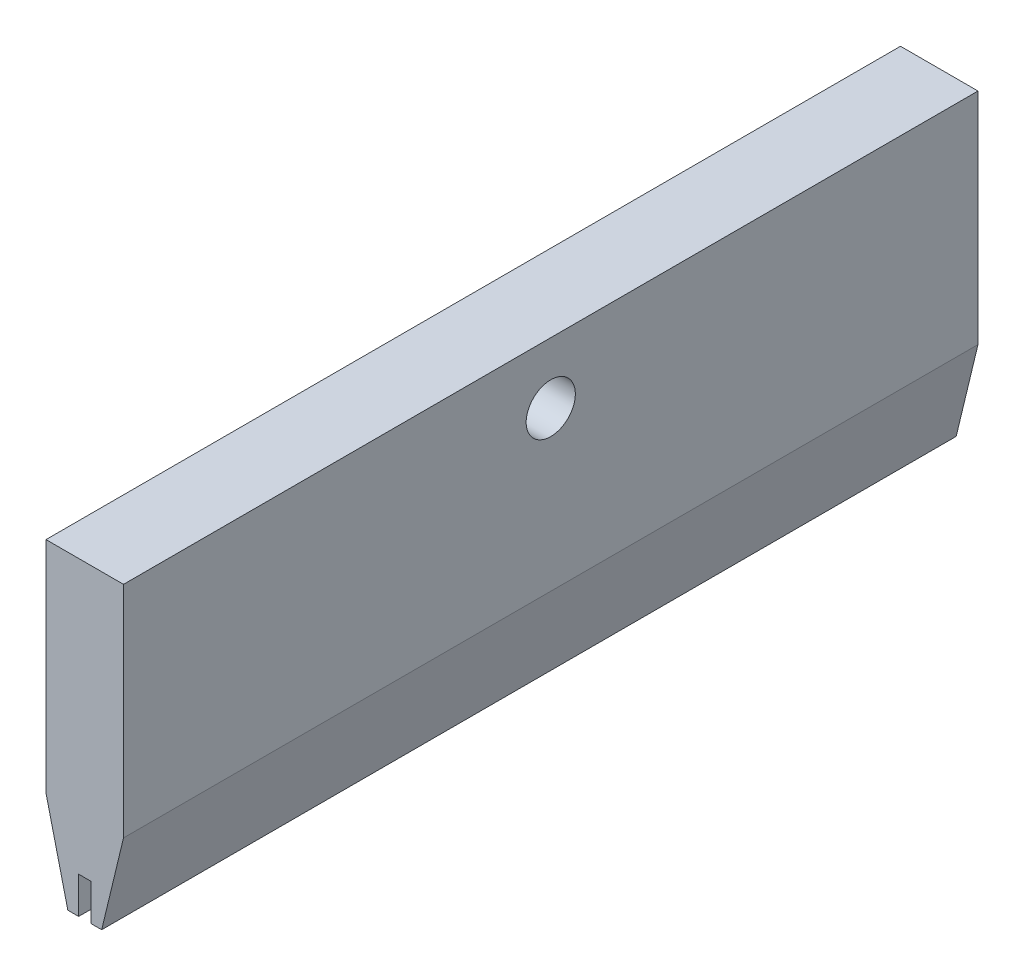
from build123d import *

# Parameters (mm, degrees)
SALIENTE_EXTRUIR1_DEPTH = 140
CROQUIS2_R              = 4.029640203
CORTAR_EXTRUIR1_DEPTH   = 140


with BuildPart() as part:
    # Croquis1 → Saliente-Extruir1 (new body)
    with BuildSketch(Plane.XY):
        Polygon((-1, -25.4), (-2.773222037, -25.4), (-6.35, -10.576393443), (-6.35, 25.4), (6.35, 25.4), (6.35, -10.576393443), (2.773222037, -25.4), (1, -25.4), (1, -19.4), (-1, -19.4), align=None)
    extrude(amount=SALIENTE_EXTRUIR1_DEPTH)

    # Croquis2 → Cortar-Extruir1 (cut)
    with BuildSketch(Plane(origin=(6.35, 0, 0), x_dir=(0, 0, -1), z_dir=(1, 0, 0))):
        with Locations((-70, 15.4)):
            Circle(CROQUIS2_R)
    extrude(amount=-CORTAR_EXTRUIR1_DEPTH, mode=Mode.SUBTRACT)


solid = part.part
